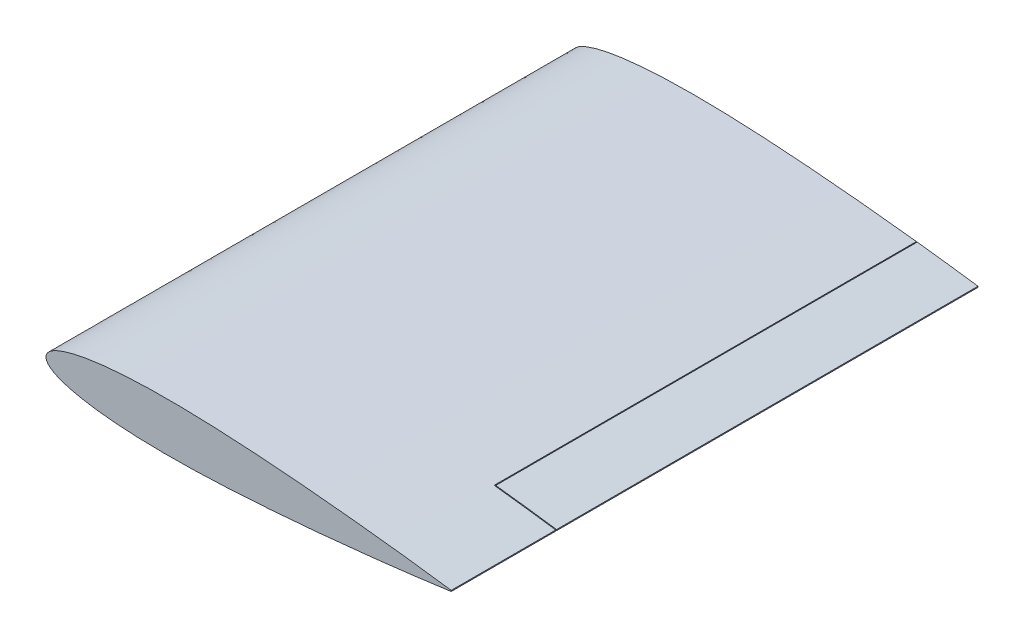
from build123d import *

# Parameters (mm, degrees)
BOSS_EXTRUDE1_DEPTH          = 165.1
CUT_EXTRUDE_THIN1_DEPTH      = 25.4
CUT_EXTRUDE_THIN1_DEPTH_BACK = 25.4
SKETCH2_W                    = 19.558
SKETCH2_H                    = 132.588
SKETCH2_W_2                  = 19.05
SKETCH2_H_2                  = 132.08


with BuildPart() as part:
    # Sketch1 → Boss-Extrude1 (new body)
    with BuildSketch(Plane.XY):
        with BuildLine():
            Line((0, 0), (0.0741553, -0.5410581))
            add(Edge.make_bspline(
                [(0.0741553, -0.5410581), (0.140193116, -0.721669288), (0.279359485, -1.102284586), (0.672953866, -1.621887631), (1.197372717, -2.127225876), (1.868546979, -2.614961799), (2.679805959, -3.087211333), (3.631807621, -3.542903378), (4.722270879, -3.981176782), (5.949220629, -4.400672498), (7.309979196, -4.800002189), (8.801569979, -5.177656111), (10.420601607, -5.532264877), (12.163391442, -5.862371272), (14.025910144, -6.166774384), (16.003859244, -6.444224904), (18.092638104, -6.693786188), (20.287392365, -6.914566798), (22.583004305, -7.105952415), (24.974124891, -7.267500336), (27.455183748, -7.398939329), (30.020387925, -7.50029876), (32.6637483, -7.571768113), (35.37909603, -7.613737924), (38.16009598, -7.6268579), (41.000252855, -7.611912582), (43.892935104, -7.569879311), (46.831388406, -7.501897019), (49.80875771, -7.409257979), (52.818088887, -7.293315259), (55.852352747, -7.155560507), (58.904465333, -6.997557268), (62.989718699, -6.76192592), (67.07428575, -6.492791876), (72.153153866, -6.122085821), (77.161565564, -5.723570073), (82.115167215, -5.291274037), (86.928545971, -4.846337775), (91.556695876, -4.396255017), (96.074209839, -3.930282916), (100.342395257, -3.472307631), (104.321343716, -3.029895637), (108.800275666, -2.509782412), (112.856241075, -2.01993467), (115.953937365, -1.632470119), (118.192651038, -1.345627894), (120.454508393, -1.051537975), (122.982051787, -0.715008334), (125.183869328, -0.413145258), (126.383583987, -0.246336664), (126.777898618, -0.191178133), (127, -0.16002)],
                knots=[0, 0, 0, 0, 0.004453098, 0.009384343, 0.014982663, 0.021372152, 0.028629372, 0.036799304, 0.0459059, 0.055958591, 0.066956833, 0.078892219, 0.091750574, 0.105513132, 0.120156922, 0.135655669, 0.151980062, 0.169098043, 0.186974925, 0.205573833, 0.224855766, 0.244779561, 0.265302077, 0.286378518, 0.307962448, 0.330005789, 0.352458937, 0.375271263, 0.398390839, 0.421764754, 0.445339233, 0.469059756, 0.492871393, 0.540546262, 0.56429809, 0.611352844, 0.65744173, 0.679988317, 0.72382058, 0.765630038, 0.785652286, 0.823696247, 0.858776431, 0.890561328, 0.918749863, 0.931410447, 0.943074149, 0.971818317, 0.990736353, 0.994781875, 1, 1, 1, 1], degree=3))
            Line((127, -0.16002), (127, 0.16002))
            add(Edge.make_bspline(
                [(0, 0), (0.014787865, 0.182587172), (0.045123671, 0.55714623), (0.289202643, 1.100069783), (0.669802119, 1.622596804), (1.198397925, 2.126995195), (1.868214507, 2.615036608), (2.679912557, 3.087187348), (3.631773923, 3.542910961), (4.72228138, 3.981174419), (5.9492174, 4.400673225), (7.309980177, 4.800001969), (8.801569684, 5.177656177), (10.420601695, 5.532264857), (12.163391416, 5.862371278), (14.025910152, 6.166774382), (16.003859242, 6.444224905), (18.092638105, 6.693786188), (20.287392365, 6.914566798), (22.583004305, 7.105952415), (24.974124891, 7.267500336), (27.455183748, 7.398939329), (30.020387925, 7.50029876), (32.6637483, 7.571768113), (35.37909603, 7.613737924), (38.16009598, 7.6268579), (41.000252855, 7.611912582), (43.892935104, 7.569879311), (46.831388406, 7.501897019), (49.80875771, 7.409257979), (52.818088887, 7.293315259), (55.852352747, 7.155560507), (58.904465333, 6.997557268), (62.989718699, 6.76192592), (67.07428575, 6.492791876), (72.153153866, 6.122085821), (77.161565564, 5.723570073), (82.115167215, 5.291274037), (86.928545971, 4.846337775), (91.556695876, 4.396255017), (96.074209839, 3.930282916), (100.342395257, 3.472307631), (104.321343716, 3.029895637), (108.800275666, 2.509782412), (112.856241075, 2.01993467), (115.953937365, 1.632470119), (118.192651038, 1.345627894), (120.454508393, 1.051537975), (122.982051787, 0.715008334), (125.183869328, 0.413145258), (126.383583987, 0.246336664), (126.777898618, 0.191178133), (127, 0.16002)],
                knots=[0, 0, 0, 0, 0.004217542, 0.008651859, 0.013562306, 0.019137014, 0.025499556, 0.032726168, 0.040861643, 0.049929832, 0.059940125, 0.070891981, 0.082777029, 0.095581153, 0.109285667, 0.123867697, 0.139301078, 0.155556621, 0.172602407, 0.190403892, 0.208924358, 0.228124969, 0.247964735, 0.268400696, 0.289388247, 0.310881146, 0.332831518, 0.355189968, 0.377906083, 0.40092815, 0.424203485, 0.447678538, 0.471299018, 0.495010229, 0.542484027, 0.566135681, 0.61299198, 0.658886484, 0.68133798, 0.724985379, 0.766618503, 0.786556306, 0.824439816, 0.859372048, 0.89102289, 0.919092539, 0.931699726, 0.943314236, 0.971937174, 0.990775422, 0.994803883, 1, 1, 1, 1], degree=3))
        make_face()
    extrude(amount=BOSS_EXTRUDE1_DEPTH)

    # Sketch2 → Cut-Extrude-Thin1 (cut, two sides: drawn at the far end of the back side and taken through both)
    with BuildSketch(Plane(origin=(0, 0, 0), x_dir=(1, 0, 0), z_dir=(0, 1, 0)).offset(-CUT_EXTRUDE_THIN1_DEPTH_BACK)):
        with Locations((117.475, -66.04)):
            Rectangle(SKETCH2_W, SKETCH2_H)
        with Locations((117.475, -66.04)):
            Rectangle(SKETCH2_W_2, SKETCH2_H_2, mode=Mode.SUBTRACT)
    extrude(amount=CUT_EXTRUDE_THIN1_DEPTH + CUT_EXTRUDE_THIN1_DEPTH_BACK, mode=Mode.SUBTRACT)


with BuildPart() as cut_extrude_thin1_piece_1:
    # of the separate pieces the step leaves, piece 1, a body of its own (cut_extrude_thin1_pieces)
    add(part.part.solids().sort_by_distance((0, 0, 0))[0])


with BuildPart() as cut_extrude_thin1_piece_2:
    # of the separate pieces the step leaves, piece 2, a body of its own (cut_extrude_thin1_pieces)
    add(part.part.solids().sort_by_distance((127, 0.16002, 0))[0])


solid = Compound([cut_extrude_thin1_piece_1.part, cut_extrude_thin1_piece_2.part])
